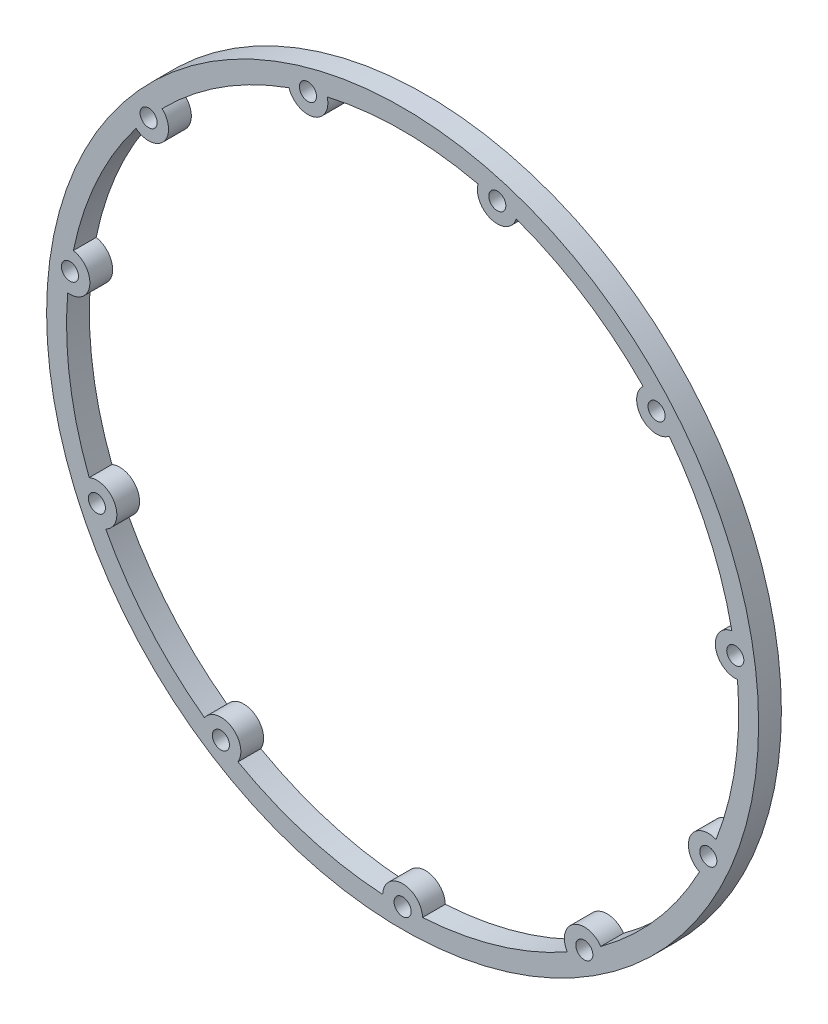
from build123d import *

# Parameters (mm, degrees)
SKETCH_1_R      = 62.5
SKETCH_1_R_2    = 1.5
EXTRUDE_1_DEPTH = 4


with BuildPart() as part:
    # 草图1 → 凸台-拉伸1 (new body)
    with BuildSketch(Plane.XY):
        Circle(SKETCH_1_R)
        with Locations((0, -59)):
            Circle(SKETCH_1_R_2, mode=Mode.SUBTRACT)
        with Locations((-31.89780823, -49.633958437)):
            Circle(SKETCH_1_R_2, mode=Mode.SUBTRACT)
        with Locations((-53.668287726, -24.509485767)):
            Circle(SKETCH_1_R_2, mode=Mode.SUBTRACT)
        with Locations((-58.399465071, 8.396575458)):
            Circle(SKETCH_1_R_2, mode=Mode.SUBTRACT)
        with Locations((-44.589224887, 38.636783303)):
            Circle(SKETCH_1_R_2, mode=Mode.SUBTRACT)
        with Locations((-16.622220854, 56.610085443)):
            Circle(SKETCH_1_R_2, mode=Mode.SUBTRACT)
        with Locations((16.622220854, 56.610085443)):
            Circle(SKETCH_1_R_2, mode=Mode.SUBTRACT)
        with Locations((44.589224887, 38.636783303)):
            Circle(SKETCH_1_R_2, mode=Mode.SUBTRACT)
        with Locations((58.399465071, 8.396575458)):
            Circle(SKETCH_1_R_2, mode=Mode.SUBTRACT)
        with Locations((53.668287726, -24.509485767)):
            Circle(SKETCH_1_R_2, mode=Mode.SUBTRACT)
        with Locations((31.89780823, -49.633958437)):
            Circle(SKETCH_1_R_2, mode=Mode.SUBTRACT)
        with BuildLine():
            ThreePointArc((3.498460053, -58.896186441), (0, -55.5), (-3.498460053, -58.896186441))
            ThreePointArc((-3.498460053, -58.896186441), (-16.622220854, -56.610085443), (-28.898590503, -51.438035217))
            ThreePointArc((-28.898590503, -51.438035217), (-30.005565369, -46.689571072), (-34.784774262, -47.65521461))
            ThreePointArc((-34.784774262, -47.65521461), (-44.589224887, -38.636783303), (-52.120542762, -27.648671255))
            ThreePointArc((-52.120542762, -27.648671255), (-50.484575742, -23.055533222), (-55.027168419, -21.284048857))
            ThreePointArc((-55.027168419, -21.284048857), (-58.399465071, -8.396575458), (-58.794590961, 4.918950474))
            ThreePointArc((-58.794590961, 4.918950474), (-54.935090024, 7.898473524), (-57.798825407, 11.844652023))
            ThreePointArc((-57.798825407, 11.844652023), (-53.668287726, 24.509485767), (-46.801771952, 35.924840183))
            ThreePointArc((-46.801771952, 35.924840183), (-41.944101377, 36.344770734), (-42.219763715, 41.212759575))
            ThreePointArc((-42.219763715, 41.212759575), (-31.89780823, 49.633958437), (-19.949721034, 55.524846967))
            ThreePointArc((-19.949721034, 55.524846967), (-15.636156905, 53.251860036), (-13.236225354, 57.496107158))
            ThreePointArc((-13.236225354, 57.496107158), (0, 59), (13.236225354, 57.496107158))
            ThreePointArc((13.236225354, 57.496107158), (15.636156905, 53.251860036), (19.949721034, 55.524846967))
            ThreePointArc((19.949721034, 55.524846967), (31.89780823, 49.633958437), (42.219763715, 41.212759575))
            ThreePointArc((42.219763715, 41.212759575), (41.944101377, 36.344770734), (46.801771952, 35.924840183))
            ThreePointArc((46.801771952, 35.924840183), (53.668287726, 24.509485767), (57.798825407, 11.844652023))
            ThreePointArc((57.798825407, 11.844652023), (54.935090024, 7.898473524), (58.794590961, 4.918950474))
            ThreePointArc((58.794590961, 4.918950474), (58.399465071, -8.396575458), (55.027168419, -21.284048857))
            ThreePointArc((55.027168419, -21.284048857), (50.484575742, -23.055533222), (52.120542762, -27.648671255))
            ThreePointArc((52.120542762, -27.648671255), (44.589224887, -38.636783303), (34.784774262, -47.65521461))
            ThreePointArc((34.784774262, -47.65521461), (30.005565369, -46.689571072), (28.898590503, -51.438035217))
            ThreePointArc((28.898590503, -51.438035217), (16.622220854, -56.610085443), (3.498460053, -58.896186441))
        make_face(mode=Mode.SUBTRACT)
    extrude(amount=EXTRUDE_1_DEPTH)


solid = part.part
